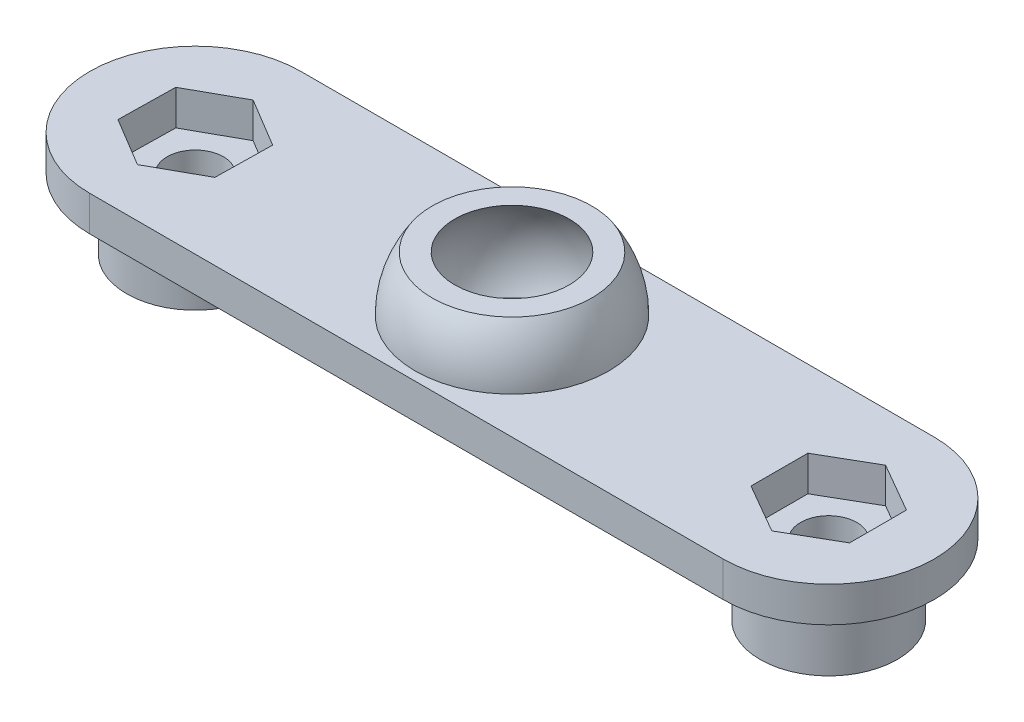
from build123d import *
from build123d.topology import SkipClean

# Parameters (mm, degrees)
SKETCH1_R           = 1.6
SKETCH1_R_2         = 4.5
BOSS_EXTRUDE1_DEPTH = 2
BOSS_EXTRUDE2_START = 4
SKETCH2_R           = 3.9
SKETCH2_R_2         = 1.6
BOSS_EXTRUDE2_DEPTH = 4
CUT_EXTRUDE1_DEPTH  = 2


with BuildPart() as part:
    # Sketch1 → Boss-Extrude1 (new body)
    with BuildSketch(Plane(origin=(0, 0, 0), x_dir=(1, 0, 0), z_dir=(0, 1, 0))):
        with BuildLine():
            Line((-18, 6), (18, 6))
            ThreePointArc((18, 6), (24, 0), (18, -6))
            Line((18, -6), (-18, -6))
            ThreePointArc((-18, -6), (-24, 0), (-18, 6))
        make_face()
        with Locations(Location((18, 0, 0), (0, 0, 270))):
            Circle(SKETCH1_R, mode=Mode.SUBTRACT)
        with Locations(Location((-18, 0, 0), (0, 0, 90))):
            Circle(SKETCH1_R, mode=Mode.SUBTRACT)
        with Locations(Location((0, 0, 0), (0, 0, 270))):
            Circle(SKETCH1_R_2, mode=Mode.SUBTRACT)
    extrude(amount=BOSS_EXTRUDE1_DEPTH)

    # Sketch2 → Boss-Extrude2 (add)
    # profile 1 of 2: a face of its own
    with SkipClean():  # the faces are left unmerged after this step: merging them gives an invalid solid
        with BuildSketch(Plane.XZ.offset(BOSS_EXTRUDE2_START)):
            with Locations(Location((-18, 0, 0), (0, 0, 90))):
                Circle(SKETCH2_R)
            with Locations(Location((-18, 0, 0), (0, 0, 270))):
                Circle(SKETCH2_R_2, mode=Mode.SUBTRACT)
        # profile 2 of 2: a face of its own
        with BuildSketch(Plane.XZ.offset(BOSS_EXTRUDE2_START)):
            with Locations(Location((18, 0, 0), (0, 0, 90))):
                Circle(SKETCH2_R)
            with Locations(Location((18, 0, 0), (0, 0, 270))):
                Circle(SKETCH2_R_2, mode=Mode.SUBTRACT)
        extrude(amount=-BOSS_EXTRUDE2_DEPTH)

    # Sketch3 → Revolve1 (revolve)
    with SkipClean():  # the faces are left unmerged after this step: merging them gives an invalid solid
        with BuildSketch(Plane(origin=(0, 0, 0), x_dir=(0, 0, -1), z_dir=(1, 0, 0))):
            with BuildLine():
                Line((-3.25, 5.112474899), (-4.534589287, 5.112474899))
                ThreePointArc((-4.534589287, 5.112474899), (-5.463872545, 2.629362224), (-5.123475383, 0))
                Line((-5.123475383, 0), (-4.031128874, 0))
                ThreePointArc((-4.031128874, 0), (-4.448377156, 2.679662181), (-3.25, 5.112474899))
            make_face()
            with BuildLine():
                Line((3.25, 5.112474899), (4.534589287, 5.112474899))
                ThreePointArc((4.534589287, 5.112474899), (5.463872545, 2.629362224), (5.123475383, 0))
                Line((5.123475383, 0), (4.031128874, 0))
                ThreePointArc((4.031128874, 0), (4.448377156, 2.679662181), (3.25, 5.112474899))
            make_face()
        revolve(axis=Axis((0, 5.800326489, 0), (0, -1, 0)))

    # Sketch4 → Cut-Extrude1 (cut)
    with BuildSketch(Plane(origin=(0, 2, 0), x_dir=(1, 0, 0), z_dir=(0, 1, 0))):
        Polygon((-15.227114181, -1.662659787), (-15.173651477, 1.570059667), (-17.946537296, 3.232719455), (-20.772885819, 1.662659787), (-20.826348523, -1.570059667), (-18.053462704, -3.232719455), align=None)
        Polygon((18, -3.233161507), (20.8, -1.616580754), (20.8, 1.616580754), (18, 3.233161507), (15.2, 1.616580754), (15.2, -1.616580754), align=None)
    extrude(amount=-CUT_EXTRUDE1_DEPTH, mode=Mode.SUBTRACT)


solid = part.part
